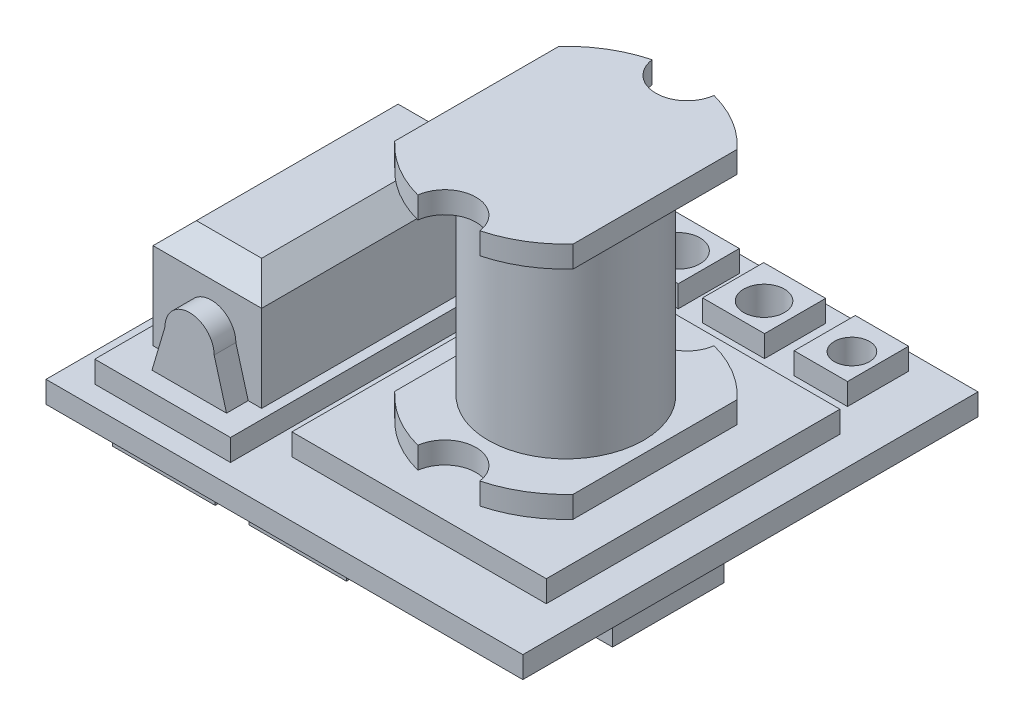
from build123d import *

# Parameters (mm, degrees)
SKETCH1_W                = 11
SKETCH1_H                = 10.5
BOSS_EXTRUDE1_DEPTH      = 7.5
SKETCH2_W                = 11
SKETCH2_H                = 10.5
SKETCH2_R                = 2.795278083
CUT_EXTRUDE1_DEPTH       = 6
CUT_EXTRUDE2_DEPTH       = 6
SKETCH5_W                = 5.867744682
SKETCH5_H                = 6.773951876
SKETCH5_W_2              = 3.131118199
SKETCH5_H_2              = 7.595162723
SKETCH5_W_3              = 1.565559099
SKETCH5_H_3              = 1.410160094
SKETCH5_W_4              = 1.497318165
SKETCH5_W_5              = 1.429294678
SKETCH5_W_6              = 1.22939712
BOSS_EXTRUDE2_DEPTH      = 0.5
SKETCH6_R                = 0.720165483
CUT_EXTRUDE3_DEPTH       = 5.5
CUT_EXTRUDE4_START       = -0.5
SKETCH7_W                = 6.315969547
SKETCH7_H                = 7.313839146
SKETCH7_R                = 1.792834501
CUT_EXTRUDE4_DEPTH       = 4.5
SKETCH8_W                = 2.504754688
SKETCH8_H                = 5.654171149
BOSS_EXTRUDE3_DEPTH      = 2.5
CHAMFER1_SIZE            = 0.5
BOSS_EXTRUDE4_DEPTH      = 0.5
BOSS_EXTRUDE4_DEPTH_BACK = 6
SKETCH11_R               = 0.448273795
SKETCH11_R_2             = 0.519161878
SKETCH11_R_3             = 0.470017501
SKETCH11_R_4             = 0.405329815
CUT_EXTRUDE5_DEPTH       = 6
SKETCH12_W               = 15.986280265
SKETCH12_H               = 22.221265256
CUT_EXTRUDE6_DEPTH       = 1
SKETCH14_W               = 2.367247422
SKETCH14_H               = 5.32267157
SKETCH14_W_2             = 2.25297781
SKETCH14_W_3             = 3.874113275
SKETCH14_H_2             = 2.566072862
BOSS_EXTRUDE5_DEPTH      = 1
SKETCH15_W               = 0.295662385
SKETCH15_H               = 1.277257847
SKETCH15_W_2             = 2.29913968
SKETCH15_H_2             = 1.589846546
BOSS_EXTRUDE6_DEPTH      = 0.25


with BuildPart() as part:
    # Sketch1 → Boss-Extrude1 (new body)
    with BuildSketch(Plane(origin=(0, 0, 0), x_dir=(1, 0, 0), z_dir=(0, 1, 0))):
        Rectangle(SKETCH1_W, SKETCH1_H)
    extrude(amount=BOSS_EXTRUDE1_DEPTH)

    # Sketch2 → Cut-Extrude1 (cut)
    with BuildSketch(Plane(origin=(0, 7.5, 0), x_dir=(1, 0, 0), z_dir=(0, 1, 0))):
        Rectangle(SKETCH2_W, SKETCH2_H)
        with Locations(Location((1.820403911, -0.575947, 0), (0, 0, 270))):
            Circle(SKETCH2_R, mode=Mode.SUBTRACT)
    extrude(amount=-CUT_EXTRUDE1_DEPTH, mode=Mode.SUBTRACT)

    # Sketch4 → Cut-Extrude2 (cut)
    with BuildSketch(Plane(origin=(0, 7.5, 0), x_dir=(1, 0, 0), z_dir=(0, 1, 0))):
        with BuildLine():
            Line((3.877357483, 1.31680802), (3.877357483, -2.46870202))
            ThreePointArc((3.877357483, -2.46870202), (4.615681994, -0.575947), (3.877357483, 1.31680802))
        make_face()
        with BuildLine():
            Line((-0.236549661, 1.31680802), (-0.236549661, -2.46870202))
            ThreePointArc((-0.236549661, -2.46870202), (-0.974874172, -0.575947), (-0.236549661, 1.31680802))
        make_face()
    extrude(amount=-CUT_EXTRUDE2_DEPTH, mode=Mode.SUBTRACT)

    # Sketch5 → Boss-Extrude2 (add)
    with BuildSketch(Plane(origin=(0, 1.5, 0), x_dir=(1, 0, 0), z_dir=(0, 1, 0))):
        with Locations((1.820403911, -0.575947)):
            Rectangle(SKETCH5_W, SKETCH5_H)
        with Locations((-3.275534534, -0.986552423)):
            Rectangle(SKETCH5_W_2, SKETCH5_H_2)
        with Locations((-2.492754984, 4.155418326)):
            Rectangle(SKETCH5_W_3, SKETCH5_H_3)
        with Locations((-0.364809348, 4.155418326)):
            Rectangle(SKETCH5_W_4, SKETCH5_H_3)
        with Locations((1.660671656, 4.155418326)):
            Rectangle(SKETCH5_W_5, SKETCH5_H_3)
        with Locations((3.673751281, 4.155418326)):
            Rectangle(SKETCH5_W_6, SKETCH5_H_3)
    extrude(amount=BOSS_EXTRUDE2_DEPTH)

    # Sketch6 → Cut-Extrude3 (cut)
    with BuildSketch(Plane(origin=(0, 7.5, 0), x_dir=(1, 0, 0), z_dir=(0, 1, 0))):
        with Locations((1.820403911, 2.219331083)):
            Circle(SKETCH6_R)
        with Locations((1.820403911, -3.371225083)):
            Circle(SKETCH6_R)
    extrude(amount=-CUT_EXTRUDE3_DEPTH, mode=Mode.SUBTRACT)

    # Sketch7 → Cut-Extrude4 (cut)
    with BuildSketch(Plane(origin=(0, 7.5, 0), x_dir=(1, 0, 0), z_dir=(0, 1, 0)).offset(CUT_EXTRUDE4_START)):
        with Locations((2.565041423, -0.688586972)):
            Rectangle(SKETCH7_W, SKETCH7_H)
        with Locations(Location((1.820403911, -0.575947, 0), (0, 0, 270))):
            Circle(SKETCH7_R, mode=Mode.SUBTRACT)
    extrude(amount=-CUT_EXTRUDE4_DEPTH, mode=Mode.SUBTRACT)

    # Sketch8 → Boss-Extrude3 (add)
    with BuildSketch(Plane(origin=(0, 2, 0), x_dir=(1, 0, 0), z_dir=(0, 1, 0))):
        with Locations((-3.183335966, -1.017589679)):
            Rectangle(SKETCH8_W, SKETCH8_H)
    extrude(amount=BOSS_EXTRUDE3_DEPTH)

    # Chamfer1
    chamfer1_edges = [part.edges().sort_by_distance(p)[0] for p in [
        (-4.43571331, 4.5, 1.017589679),
        (-3.183335966, 4.5, 3.844675254),
        (-1.930958622, 4.5, 1.017589679),
        (-3.183335966, 4.5, -1.809495895),
    ]]
    chamfer(chamfer1_edges, length=CHAMFER1_SIZE)

    # Sketch9 → Boss-Extrude4 (add, two sides: drawn at the far end of the back side and taken through both)
    with BuildSketch(Plane.XY.offset(3.844675254).offset(-BOSS_EXTRUDE4_DEPTH_BACK)):
        with BuildLine():
            Line((-3.65938344, 3.018172096), (-3.960413084, 2))
            Line((-3.960413084, 2), (-2.240880522, 2))
            Line((-2.240880522, 2), (-2.525820591, 3.018172096))
            ThreePointArc((-2.525820591, 3.018172096), (-3.092602015, 3.584953521), (-3.65938344, 3.018172096))
        make_face()
    extrude(amount=BOSS_EXTRUDE4_DEPTH + BOSS_EXTRUDE4_DEPTH_BACK)

    # Sketch11 → Cut-Extrude5 (cut)
    with BuildSketch(Plane(origin=(0, 2, 0), x_dir=(1, 0, 0), z_dir=(0, 1, 0))):
        with Locations(Location((-2.434309819, 4.1008725, 0), (0, 0, 270))):
            Circle(SKETCH11_R)
        with Locations(Location((-0.282142489, 4.1008725, 0), (0, 0, 270))):
            Circle(SKETCH11_R_2)
        with Locations(Location((1.714254577, 4.1008725, 0), (0, 0, 270))):
            Circle(SKETCH11_R_3)
        with Locations(Location((3.740407892, 4.1008725, 0), (0, 0, 270))):
            Circle(SKETCH11_R_4)
    extrude(amount=-CUT_EXTRUDE5_DEPTH, mode=Mode.SUBTRACT)

    # Sketch12 → Cut-Extrude6 (cut)
    with BuildSketch(Plane.XZ):
        with Locations((0.612445896, -2.778297047)):
            Rectangle(SKETCH12_W, SKETCH12_H)
    extrude(amount=-CUT_EXTRUDE6_DEPTH, mode=Mode.SUBTRACT)

    # Sketch14 → Boss-Extrude5 (add)
    with BuildSketch(Plane.XZ.offset(-1)):
        with Locations((-3.713682192, 1.657442308)):
            Rectangle(SKETCH14_W, SKETCH14_H)
        with Locations((-0.626830267, 1.657442308)):
            Rectangle(SKETCH14_W_2, SKETCH14_H)
        with Locations((2.948180384, 1.283036431)):
            Rectangle(SKETCH14_W_3, SKETCH14_H_2)
    extrude(amount=BOSS_EXTRUDE5_DEPTH)

    # Sketch15 → Boss-Extrude6 (add)
    with BuildSketch(Plane.XZ.offset(-1)):
        with Locations((1.762732856, -0.322099443)):
            Rectangle(SKETCH15_W, SKETCH15_H)
        with Locations((2.880831271, -0.322099443)):
            Rectangle(SKETCH15_W, SKETCH15_H)
        with Locations((4.061872536, -0.322099443)):
            Rectangle(SKETCH15_W, SKETCH15_H)
        with Locations((2.912302696, 3.03749296)):
            Rectangle(SKETCH15_W_2, SKETCH15_H_2)
    extrude(amount=BOSS_EXTRUDE6_DEPTH)


solid = part.part
